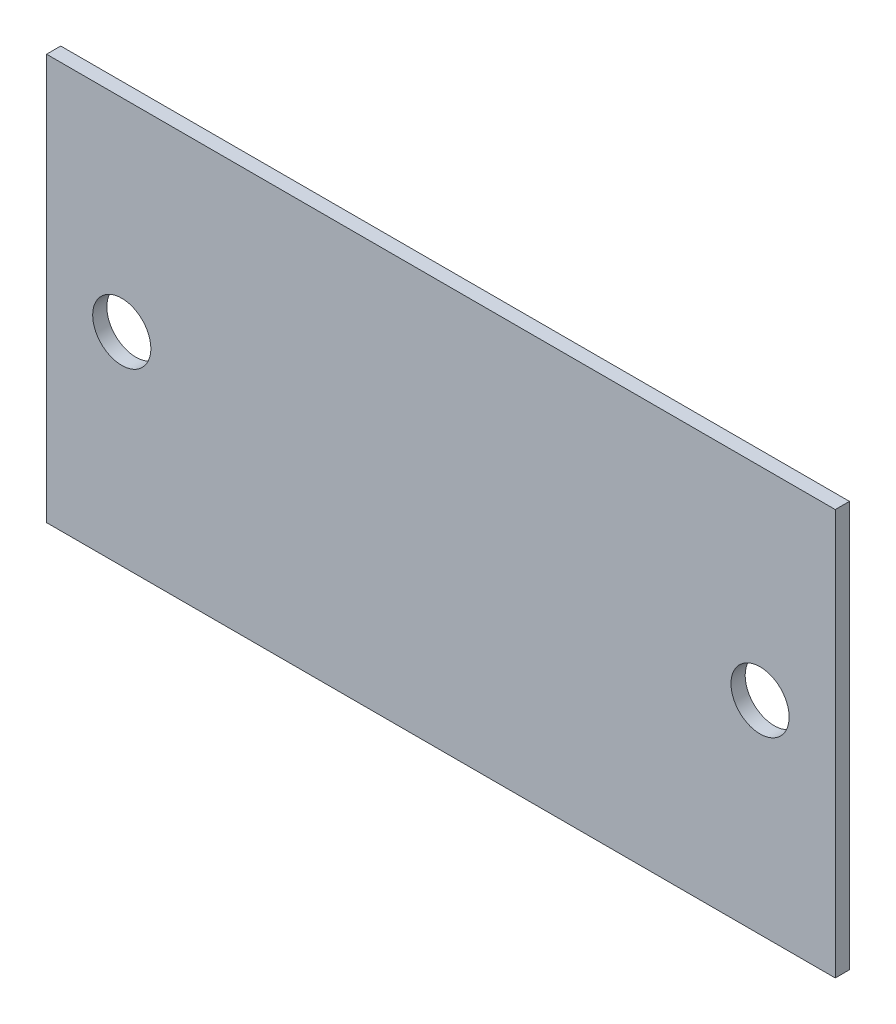
from build123d import *

# Parameters (mm, degrees)
SKIZZE1_W                       = 55.6
SKIZZE1_H                       = 28.6
SKIZZE1_R                       = 2.05
AUFSATZ_LINEAR_AUSTRAGEN1_DEPTH = 1


with BuildPart() as part:
    # Skizze1 → Aufsatz-Linear austragen1 (new body)
    with BuildSketch(Plane(origin=(0, 0, -37), x_dir=(-1, 0, 0), z_dir=(0, 0, -1))):
        with Locations((0, 107.872767975)):
            Rectangle(SKIZZE1_W, SKIZZE1_H)
        with Locations((-22.5, 107.872767975)):
            Circle(SKIZZE1_R, mode=Mode.SUBTRACT)
        with Locations((22.5, 107.872767975)):
            Circle(SKIZZE1_R, mode=Mode.SUBTRACT)
    extrude(amount=AUFSATZ_LINEAR_AUSTRAGEN1_DEPTH)


solid = part.part
